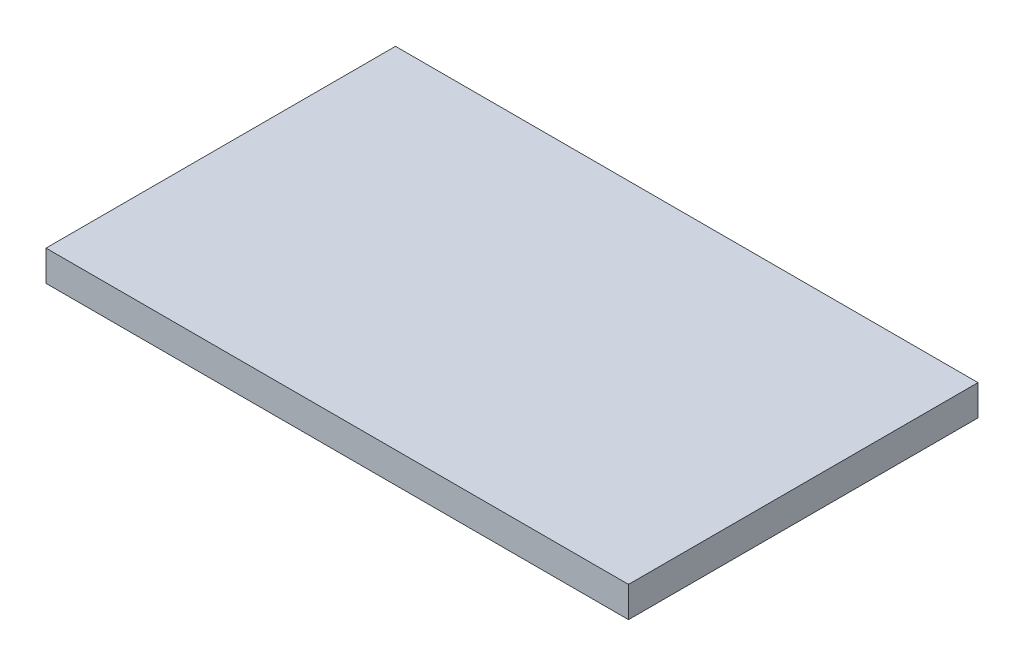
from build123d import *

# Parameters (mm, degrees)
SKETCH1_W           = 38.1
SKETCH1_H           = 22.86
BOSS_EXTRUDE1_DEPTH = 2


with BuildPart() as part:
    # Sketch1 → Boss-Extrude1 (new body)
    with BuildSketch(Plane(origin=(0, 0, 0), x_dir=(1, 0, 0), z_dir=(0, 1, 0))):
        with Locations((-19.05, 11.43)):
            Rectangle(SKETCH1_W, SKETCH1_H)
    extrude(amount=BOSS_EXTRUDE1_DEPTH)


solid = part.part
